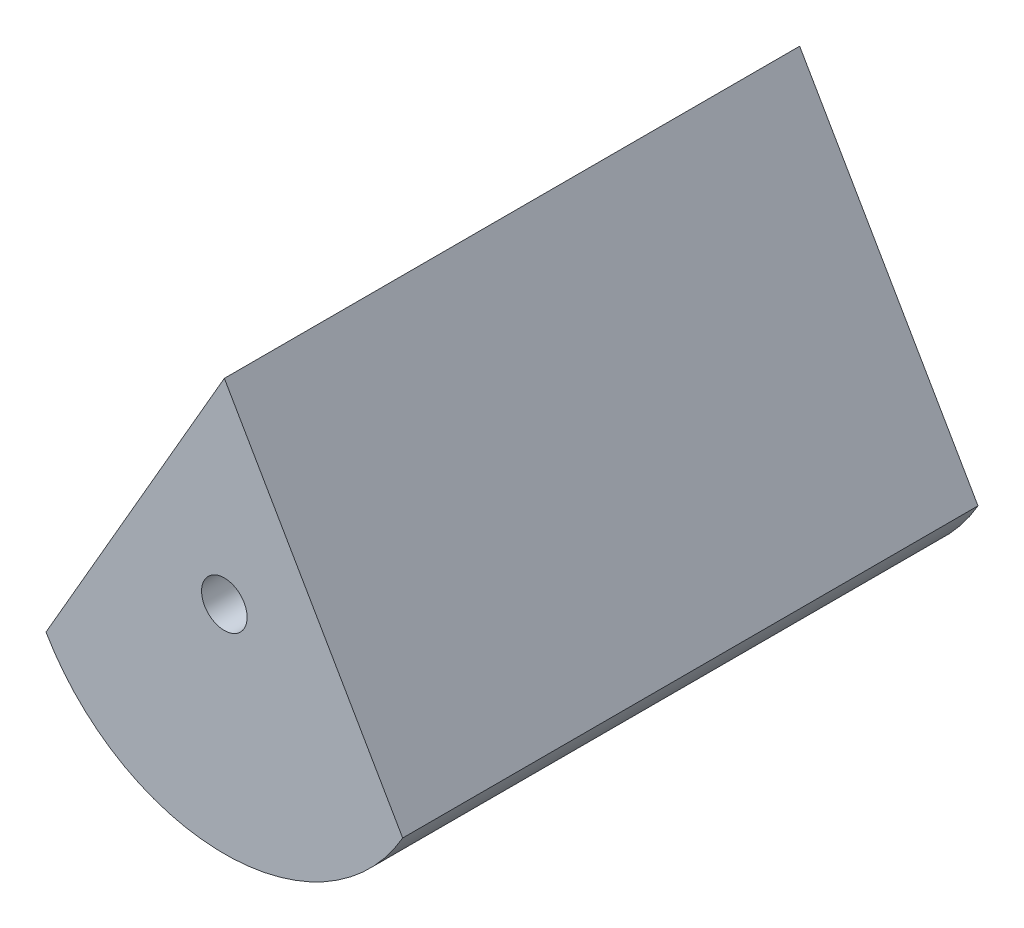
from build123d import *

# Parameters (mm, degrees)
Y_KSEKLIK_EKSTR_ZYON1_DEPTH = 50
IZIM2_R                     = 1.979898987
KES_EKSTR_ZYON1_DEPTH       = 50


with BuildPart() as part:
    # Çizim1 → Yükseklik-Ekstrüzyon1 (new body)
    with BuildSketch(Plane.XY):
        with BuildLine():
            Line((0, 17.897858345), (-15.5, -8.948929172))
            ThreePointArc((-15.5, -8.948929172), (0, -17.897858345), (15.5, -8.948929172))
            Line((15.5, -8.948929172), (0, 17.897858345))
        make_face()
    extrude(amount=Y_KSEKLIK_EKSTR_ZYON1_DEPTH)

    # Çizim2 → Kes-Ekstrüzyon1 (cut)
    with BuildSketch(Plane.XY.offset(50)):
        with Locations((0, 0.897858345)):
            Circle(IZIM2_R)
    extrude(amount=-KES_EKSTR_ZYON1_DEPTH, mode=Mode.SUBTRACT)


solid = part.part
